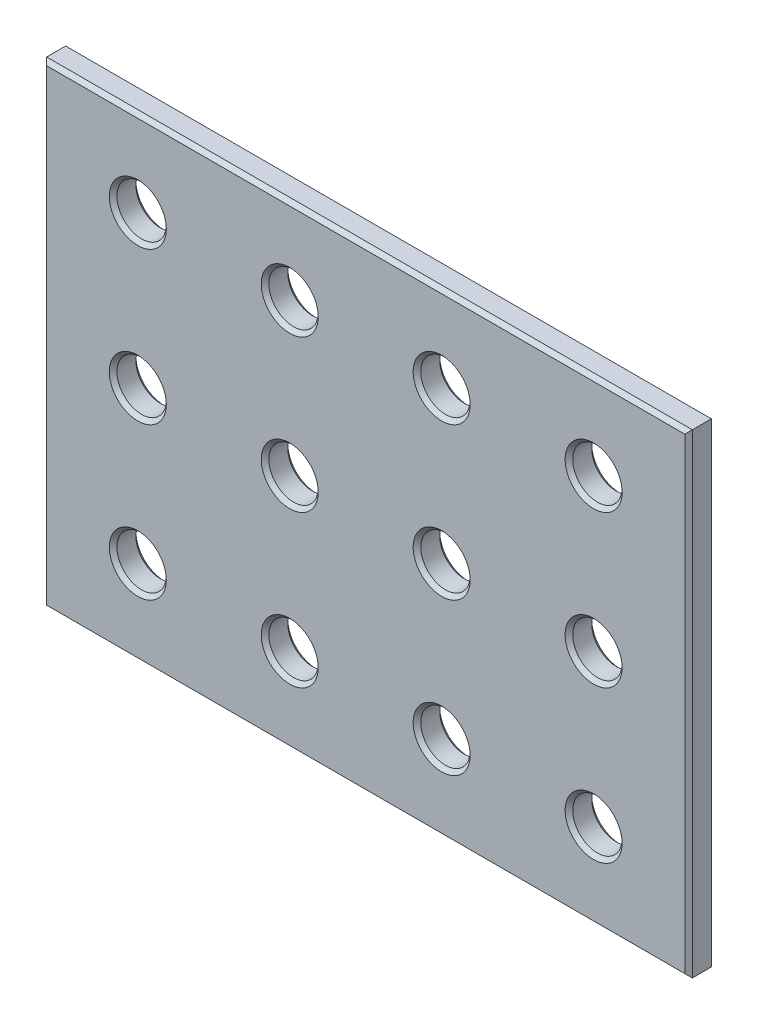
from build123d import *

# Parameters (mm, degrees)
SKETCH_1_W        = 340
SKETCH_1_H        = 250
SKETCH_1_R        = 13
EXTRUDE_448_DEPTH = 14
CHAMFER_1_SIZE    = 2


with BuildPart() as part:
    # 草图1 → Extrude 448 (new body)
    with BuildSketch(Plane.XY):
        Rectangle(SKETCH_1_W, SKETCH_1_H)
        with Locations((-120, 80)):
            Circle(SKETCH_1_R, mode=Mode.SUBTRACT)
        with Locations((-40, 80)):
            Circle(SKETCH_1_R, mode=Mode.SUBTRACT)
        with Locations((-40, 0)):
            Circle(SKETCH_1_R, mode=Mode.SUBTRACT)
        with Locations((-120, 0)):
            Circle(SKETCH_1_R, mode=Mode.SUBTRACT)
        with Locations(Location((-40, -80, 0), (0, 0, 180))):
            Circle(SKETCH_1_R, mode=Mode.SUBTRACT)
        with Locations(Location((-120, -80, 0), (0, 0, 180))):
            Circle(SKETCH_1_R, mode=Mode.SUBTRACT)
        with Locations((120, -80)):
            Circle(SKETCH_1_R, mode=Mode.SUBTRACT)
        with Locations((40, -80)):
            Circle(SKETCH_1_R, mode=Mode.SUBTRACT)
        with Locations(Location((120, 0, 0), (0, 0, 180))):
            Circle(SKETCH_1_R, mode=Mode.SUBTRACT)
        with Locations(Location((40, 0, 0), (0, 0, 180))):
            Circle(SKETCH_1_R, mode=Mode.SUBTRACT)
        with Locations(Location((40, 80, 0), (0, 0, 180))):
            Circle(SKETCH_1_R, mode=Mode.SUBTRACT)
        with Locations(Location((120, 80, 0), (0, 0, 180))):
            Circle(SKETCH_1_R, mode=Mode.SUBTRACT)
    extrude(amount=EXTRUDE_448_DEPTH)

    # 倒角1
    chamfer_1_edges = [part.edges().sort_by_distance(p)[0] for p in [
        (170, 0, 14),
        (-133, 80, 0),
        (-133, 80, 14),
        (0, 125, 14),
        (-53, 80, 0),
        (-53, 80, 14),
        (-53, 0, 0),
        (-53, 0, 14),
        (-133, 0, 0),
        (-133, 0, 14),
        (-27, -80, 0),
        (-27, -80, 14),
        (-107, -80, 0),
        (-107, -80, 14),
        (107, -80, 0),
        (107, -80, 14),
        (27, -80, 0),
        (27, -80, 14),
        (-170, 0, 14),
        (133, 0, 0),
        (133, 0, 14),
        (0, 125, 0),
        (53, 0, 0),
        (53, 0, 14),
        (170, 0, 0),
        (53, 80, 0),
        (53, 80, 14),
        (0, -125, 0),
        (133, 80, 0),
        (133, 80, 14),
        (-170, 0, 0),
        (0, -125, 14),
    ]]
    chamfer(chamfer_1_edges, length=CHAMFER_1_SIZE)


solid = part.part
